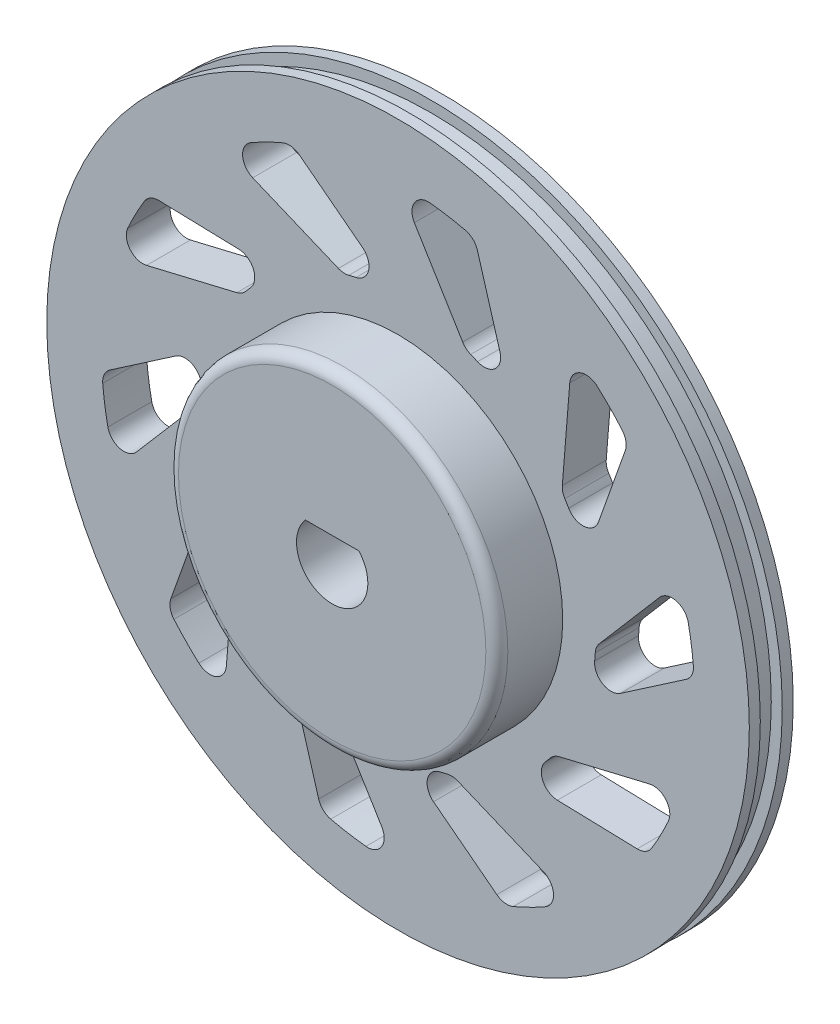
from build123d import *

# Parameters (mm, degrees)
SKETCH_1_R          = 31
EXTRUDE_2_DEPTH     = 2
SKETCH_2_R          = 32
EXTRUDE_3_DEPTH     = 1
EXTRUDE_START       = 1
SKETCH_3_R          = 32
EXTRUDE_4_DEPTH     = 1
SKETCH_6_R          = 15
EXTRUDE_6_DEPTH     = 6
CUT_EXTRUDE_4_DEPTH = 47.346520905
CUT_EXTRUDE_5_DEPTH = 46.650848842
FILLET_1_R          = 1


with BuildPart() as part:
    # Эскиз1 → Бобышка-Вытянуть2 (new body)
    with BuildSketch(Plane.XY):
        Circle(SKETCH_1_R)
    extrude(amount=EXTRUDE_2_DEPTH)

    # Эскиз2 → Бобышка-Вытянуть3 (add)
    with BuildSketch(Plane.XY.offset(2)):
        Circle(SKETCH_2_R)
    extrude(amount=EXTRUDE_3_DEPTH)

    # Эскиз3 → Бобышка-Вытянуть4 (add)
    with BuildSketch(Plane(origin=(0, 0, 0), x_dir=(-1, 0, 0), z_dir=(0, 0, -1)).offset(EXTRUDE_START)):
        with Locations(Location((0, 0, 0), (0, 0, 180))):
            Circle(SKETCH_3_R)
    extrude(amount=-EXTRUDE_4_DEPTH)

    # Эскиз6 → Бобышка-Вытянуть6 (add)
    with BuildSketch(Plane.XY.offset(3)):
        Circle(SKETCH_6_R)
    extrude(amount=EXTRUDE_6_DEPTH)

    # Эскиз4 → Вырез-Вытянуть4 (cut, through all)
    with BuildSketch(Plane(origin=(0, 0, -1), x_dir=(-1, 0, 0), z_dir=(0, 0, -1))):
        with BuildLine():
            Line((2.437211521, 2.15), (-2.437211521, 2.15))
            ThreePointArc((-2.437211521, 2.15), (0, -3.25), (2.437211521, 2.15))
        make_face()
    extrude(amount=-CUT_EXTRUDE_4_DEPTH, mode=Mode.SUBTRACT)

    # Эскиз7 → Вырез-Вытянуть5 (cut, through all)
    with BuildSketch(Plane.XY.offset(3)):
        with BuildLine():
            Line((9.285237927, 18.275304959), (7.230289651, 25.257183657))
            ThreePointArc((7.230289651, 25.257183657), (6.821254579, 25.924181107), (6.13198861, 26.294461692))
            ThreePointArc((6.13198861, 26.294461692), (4.537919562, 26.615921665), (2.927389551, 26.840834384))
            ThreePointArc((2.927389551, 26.840834384), (1.498432034, 26.153680395), (1.484437775, 24.56815072))
            Line((1.484437775, 24.56815072), (5.888797985, 17.352799301))
            ThreePointArc((5.888797985, 17.352799301), (6.203231476, 16.986690916), (6.617646469, 16.739377384))
            ThreePointArc((6.617646469, 16.739377384), (6.931405833, 16.611911786), (7.242711556, 16.478565754))
            ThreePointArc((7.242711556, 16.478565754), (8.83700012, 16.725522261), (9.285237927, 18.275304959))
        make_face()
        with BuildLine():
            Line((14.963857162, 10.577360926), (15.641732056, 19.003520821))
            ThreePointArc((15.641732056, 19.003520821), (16.58500461, 20.278015654), (18.144954506, 19.994014754))
            ThreePointArc((18.144954506, 19.994014754), (19.315700275, 18.865410753), (20.416379794, 17.668373895))
            ThreePointArc((20.416379794, 17.668373895), (20.75636221, 16.963670237), (20.69522727, 16.183633182))
            Line((20.69522727, 16.183633182), (18.253870016, 9.327306371))
            ThreePointArc((18.253870016, 9.327306371), (16.980298598, 8.336973404), (15.545334663, 9.074280699))
            ThreePointArc((15.545334663, 9.074280699), (15.371861874, 9.365140817), (15.192947615, 9.65268578))
            ThreePointArc((15.192947615, 9.65268578), (15.003046089, 10.096353651), (14.963857162, 10.577360926))
        make_face()
        with BuildLine():
            Line((18.323231505, -0.238269813), (23.824416335, 6.180191874))
            ThreePointArc((23.824416335, 6.180191874), (25.336669128, 6.656838157), (26.431763564, 5.510161059))
            ThreePointArc((26.431763564, 5.510161059), (26.71554, 3.908954146), (26.902407825, 2.293567795))
            ThreePointArc((26.902407825, 2.293567795), (26.763244959, 1.52361391), (26.255291476, 0.928484893))
            Line((26.255291476, 0.928484893), (20.250144185, -3.183406226))
            ThreePointArc((20.250144185, -3.183406226), (18.637700151, -3.23601593), (17.910168296, -1.79607116))
            ThreePointArc((17.910168296, -1.79607116), (17.940789149, -1.458795634), (17.965059162, -1.12100371))
            ThreePointArc((17.965059162, -1.12100371), (18.072207032, -0.650447546), (18.323231505, -0.238269813))
        make_face()
        with BuildLine():
            Line((14.683754198, -10.962889581), (22.906983336, -9.003760312))
            ThreePointArc((22.906983336, -9.003760312), (24.410587201, -9.507025258), (24.622537323, -11.078386876))
            ThreePointArc((24.622537323, -11.078386876), (23.910951473, -12.540590085), (23.112630445, -13.957303246))
            ThreePointArc((23.112630445, -13.957303246), (22.547477783, -14.498411144), (21.786726723, -14.681313067))
            Line((21.786726723, -14.681313067), (14.511551552, -14.478165846))
            ThreePointArc((14.511551552, -14.478165846), (13.176133719, -13.572957167), (13.433926384, -11.980384882))
            ThreePointArc((13.433926384, -11.980384882), (13.656944755, -11.725521735), (13.875128718, -11.466507884))
            ThreePointArc((13.875128718, -11.466507884), (14.23839914, -11.148799888), (14.683754198, -10.962889581))
        make_face()
        with BuildLine():
            Line((5.435581869, -17.500058144), (13.239861282, -20.748582085))
            ThreePointArc((13.239861282, -20.748582085), (14.160490649, -22.039528156), (13.408338714, -23.435367566))
            ThreePointArc((13.408338714, -23.435367566), (11.973192186, -24.200055142), (10.494613805, -24.876958839))
            ThreePointArc((10.494613805, -24.876958839), (9.719340455, -24.982535925), (8.996372866, -24.683348435))
            Line((8.996372866, -24.683348435), (3.230039456, -20.242758207))
            ThreePointArc((3.230039456, -20.242758207), (2.681732046, -18.725490094), (3.826381195, -17.588598777))
            ThreePointArc((3.826381195, -17.588598777), (4.156611646, -17.51349707), (4.485370703, -17.432195779))
            ThreePointArc((4.485370703, -17.432195779), (4.966006722, -17.388689607), (5.435581869, -17.500058144))
        make_face()
        with BuildLine():
            Line((-5.888797985, -17.352799301), (-1.484437775, -24.56815072))
            ThreePointArc((-1.484437775, -24.56815072), (-1.498432034, -26.153680395), (-2.927389551, -26.840834384))
            ThreePointArc((-2.927389551, -26.840834384), (-4.537919562, -26.615921665), (-6.13198861, -26.294461692))
            ThreePointArc((-6.13198861, -26.294461692), (-6.821254579, -25.924181107), (-7.230289651, -25.257183657))
            Line((-7.230289651, -25.257183657), (-9.285237927, -18.275304959))
            ThreePointArc((-9.285237927, -18.275304959), (-8.83700012, -16.725522261), (-7.242711556, -16.478565754))
            ThreePointArc((-7.242711556, -16.478565754), (-6.931405833, -16.611911786), (-6.617646469, -16.739377384))
            ThreePointArc((-6.617646469, -16.739377384), (-6.203231476, -16.986690916), (-5.888797985, -17.352799301))
        make_face()
        with BuildLine():
            Line((-14.963857162, -10.577360926), (-15.641732056, -19.003520821))
            ThreePointArc((-15.641732056, -19.003520821), (-16.58500461, -20.278015654), (-18.144954506, -19.994014754))
            ThreePointArc((-18.144954506, -19.994014754), (-19.315700275, -18.865410753), (-20.416379794, -17.668373895))
            ThreePointArc((-20.416379794, -17.668373895), (-20.75636221, -16.963670237), (-20.69522727, -16.183633182))
            Line((-20.69522727, -16.183633182), (-18.253870016, -9.327306371))
            ThreePointArc((-18.253870016, -9.327306371), (-16.980298598, -8.336973404), (-15.545334663, -9.074280699))
            ThreePointArc((-15.545334663, -9.074280699), (-15.371861874, -9.365140817), (-15.192947615, -9.65268578))
            ThreePointArc((-15.192947615, -9.65268578), (-15.003046089, -10.096353651), (-14.963857162, -10.577360926))
        make_face()
        with BuildLine():
            Line((-18.323231505, 0.238269813), (-23.824416335, -6.180191874))
            ThreePointArc((-23.824416335, -6.180191874), (-25.336669128, -6.656838157), (-26.431763564, -5.510161059))
            ThreePointArc((-26.431763564, -5.510161059), (-26.71554, -3.908954146), (-26.902407825, -2.293567795))
            ThreePointArc((-26.902407825, -2.293567795), (-26.763244959, -1.52361391), (-26.255291476, -0.928484893))
            Line((-26.255291476, -0.928484893), (-20.250144185, 3.183406226))
            ThreePointArc((-20.250144185, 3.183406226), (-18.637700151, 3.23601593), (-17.910168296, 1.79607116))
            ThreePointArc((-17.910168296, 1.79607116), (-17.940789149, 1.458795634), (-17.965059162, 1.12100371))
            ThreePointArc((-17.965059162, 1.12100371), (-18.072207032, 0.650447546), (-18.323231505, 0.238269813))
        make_face()
        with BuildLine():
            Line((-14.683754198, 10.962889581), (-22.906983336, 9.003760312))
            ThreePointArc((-22.906983336, 9.003760312), (-24.410587201, 9.507025258), (-24.622537323, 11.078386876))
            ThreePointArc((-24.622537323, 11.078386876), (-23.910951473, 12.540590085), (-23.112630445, 13.957303246))
            ThreePointArc((-23.112630445, 13.957303246), (-22.547477783, 14.498411144), (-21.786726723, 14.681313067))
            Line((-21.786726723, 14.681313067), (-14.511551552, 14.478165846))
            ThreePointArc((-14.511551552, 14.478165846), (-13.176133719, 13.572957167), (-13.433926384, 11.980384882))
            ThreePointArc((-13.433926384, 11.980384882), (-13.656944755, 11.725521735), (-13.875128718, 11.466507884))
            ThreePointArc((-13.875128718, 11.466507884), (-14.23839914, 11.148799888), (-14.683754198, 10.962889581))
        make_face()
        with BuildLine():
            Line((-5.435581869, 17.500058144), (-13.239861282, 20.748582085))
            ThreePointArc((-13.239861282, 20.748582085), (-14.160490649, 22.039528156), (-13.408338714, 23.435367566))
            ThreePointArc((-13.408338714, 23.435367566), (-11.973192186, 24.200055142), (-10.494613805, 24.876958839))
            ThreePointArc((-10.494613805, 24.876958839), (-9.719340455, 24.982535925), (-8.996372866, 24.683348435))
            Line((-8.996372866, 24.683348435), (-3.230039456, 20.242758207))
            ThreePointArc((-3.230039456, 20.242758207), (-2.681732046, 18.725490094), (-3.826381195, 17.588598777))
            ThreePointArc((-3.826381195, 17.588598777), (-4.156611646, 17.51349707), (-4.485370703, 17.432195779))
            ThreePointArc((-4.485370703, 17.432195779), (-4.966006722, 17.388689607), (-5.435581869, 17.500058144))
        make_face()
    extrude(amount=-CUT_EXTRUDE_5_DEPTH, mode=Mode.SUBTRACT)

    # Скругление1
    fillet_1_edges = [part.edges().sort_by_distance(p)[0] for p in [
        (-15, 0, 9),
    ]]
    fillet(fillet_1_edges, radius=FILLET_1_R)


solid = part.part
